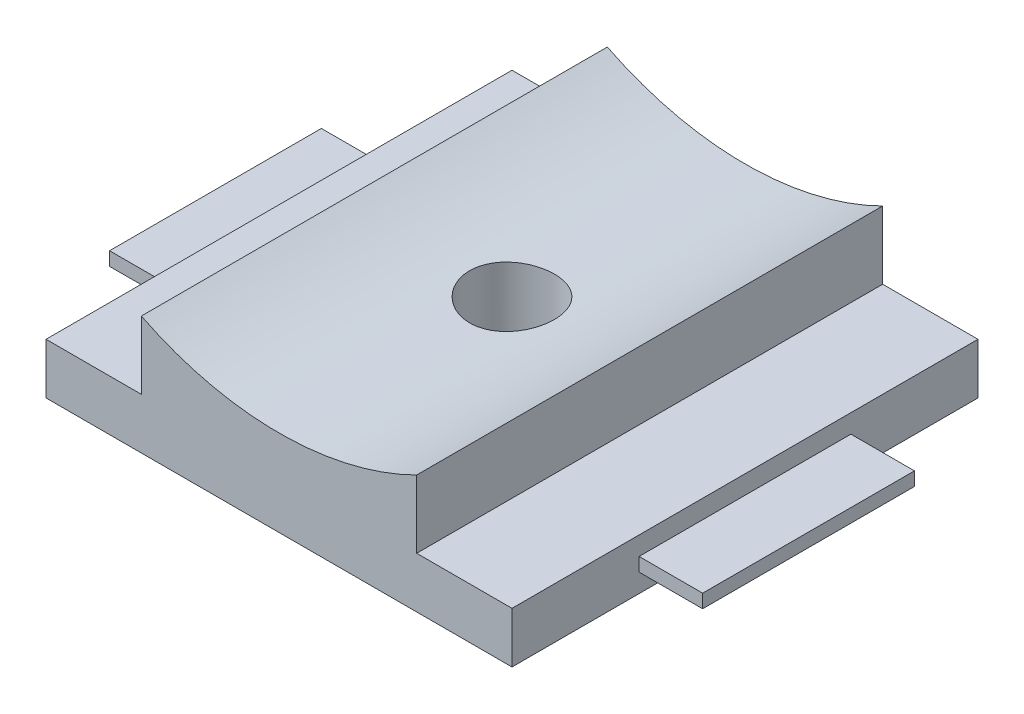
from build123d import *

# Parameters (mm, degrees)
BOSS_EXTRUDE1_DEPTH     = 27.94
CUT_EXTRUDE1_REACH      = 40.203
CUT_EXTRUDE1_END_RADIUS = 18.480456736
SKETCH2_R               = 2.54
SKETCH3_W               = 12.7
SKETCH3_H               = 0.8128
BOSS_EXTRUDE2_DEPTH     = 3.81
SKETCH4_W               = 12.7
SKETCH4_H               = 0.8128
BOSS_EXTRUDE3_DEPTH     = 3.81


with BuildPart() as part:
    # Sketch1 → Boss-Extrude1 (new body)
    with BuildSketch(Plane.XY):
        with BuildLine():
            Line((-25.065129767, -11.56137931), (2.874870233, -11.56137931))
            Line((2.874870233, -11.56137931), (2.874870233, -8.51337931))
            Line((2.874870233, -8.51337931), (-2.840129767, -8.51337931))
            Line((-2.840129767, -8.51337931), (-2.840129767, -4.44937931))
            ThreePointArc((-2.840129767, -4.44937931), (-11.095129767, -6.395560853), (-19.350129767, -4.44937931))
            Line((-19.350129767, -4.44937931), (-19.350129767, -8.51337931))
            Line((-19.350129767, -8.51337931), (-25.065129767, -8.51337931))
            Line((-25.065129767, -8.51337931), (-25.065129767, -11.56137931))
        make_face()
    extrude(amount=BOSS_EXTRUDE1_DEPTH)

    # Cut-Extrude1: up to this cylinder (the profile starts outside it)
    cut_extrude1_end = Plane(origin=(-11.095129767, 12.084895883, 13.97), z_dir=(0, 0, -1)) * Cylinder(CUT_EXTRUDE1_END_RADIUS, 118.366913471, mode=Mode.PRIVATE)
    # Sketch2 → Cut-Extrude1 (cut, up to the surface)
    with BuildSketch(Plane.XZ.offset(11.56137931), mode=Mode.PRIVATE) as cut_extrude1_sk1:
        with Locations(Location((-11.095129767, 13.97, 0), (0, 0, 270))):
            Circle(SKETCH2_R)
    cut_extrude1_tool1 = extrude(cut_extrude1_sk1.sketch, amount=-CUT_EXTRUDE1_REACH, mode=Mode.PRIVATE) - cut_extrude1_end
    add(cut_extrude1_tool1.solids().sort_by_distance((-11.09513, -11.561379, 13.97))[0], mode=Mode.SUBTRACT)

    # Sketch3 → Boss-Extrude2 (add)
    with BuildSketch(Plane(origin=(2.874870233, 0, 0), x_dir=(0, 0, -1), z_dir=(1, 0, 0))):
        with Locations((-13.97, -10.03737931)):
            Rectangle(SKETCH3_W, SKETCH3_H)
    extrude(amount=BOSS_EXTRUDE2_DEPTH)

    # Sketch4 → Boss-Extrude3 (add)
    with BuildSketch(Plane.ZY.offset(25.065129767)):
        with Locations((13.97, -10.03737931)):
            Rectangle(SKETCH4_W, SKETCH4_H)
    extrude(amount=BOSS_EXTRUDE3_DEPTH)


solid = part.part
